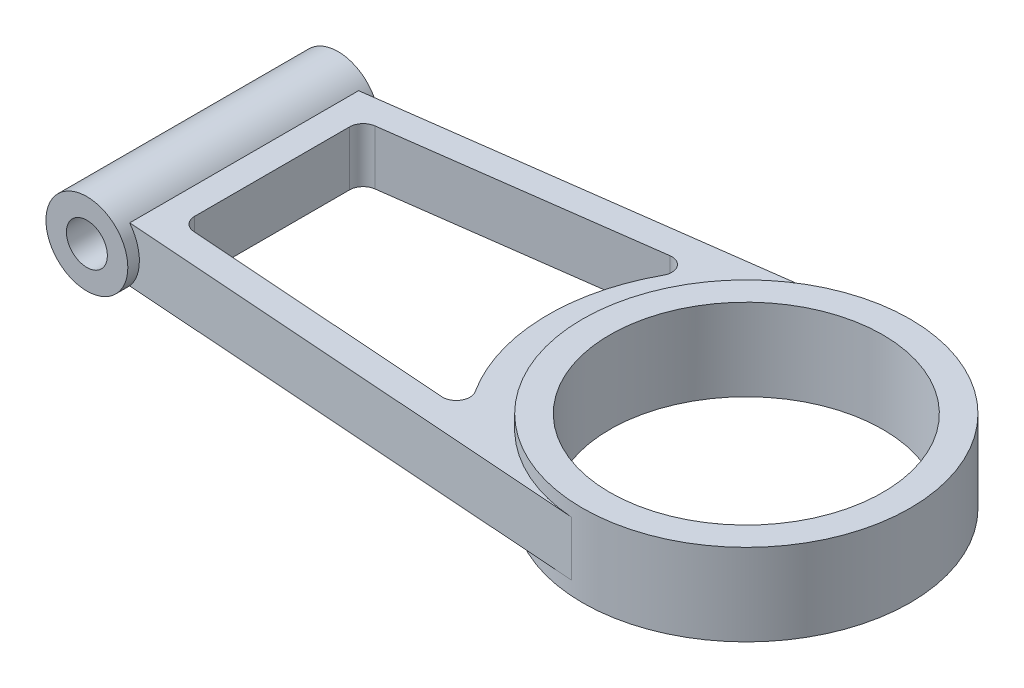
from build123d import *
from build123d.topology import SkipClean

# Parameters (mm, degrees)
SKETCH1_R           = 50
BOSS_EXTRUDE4_DEPTH = 10
SKETCH4_R           = 50
BOSS_EXTRUDE5_DEPTH = 5
BOSS_EXTRUDE6_START = 5
SKETCH5_R           = 50
BOSS_EXTRUDE6_DEPTH = 5
SKETCH9_R           = 15
SKETCH9_R_2         = 7.5
BOSS_EXTRUDE8_DEPTH = 40
CUT_EXTRUDE1_START  = 50
SKETCH11_R          = 15
CUT_EXTRUDE1_DEPTH  = 50
BOSS_EXTRUDE9_START = 12
SKETCH12_R          = 7.5
BOSS_EXTRUDE9_DEPTH = 12


with BuildPart() as part:
    # Sketch1 → Boss-Extrude4 (new, symmetric)
    # profile 1 of 2: a face of its own
    with BuildSketch(Plane(origin=(0, 0, 0), x_dir=(1, 0, 0), z_dir=(0, 1, 0))):
        with BuildLine():
            Line((109.631487436, 59.370873009), (-60.952961118, 36.317806))
            Line((-60.952961118, 36.317806), (-60.952961118, -47.492515538))
            Line((-60.952961118, -47.492515538), (113.395395748, -59.936377162))
            ThreePointArc((113.395395748, -59.936377162), (57.696778774, -1.980561591), (109.631487436, 59.370873009))
        make_face()
        with BuildLine():
            Line((-46.622582391, 28.163534109), (48.543183, 41.024394434))
            ThreePointArc((48.543183, 41.024394434), (53.334657365, 38.899688702), (53.596610708, 33.664807473))
            ThreePointArc((53.596610708, 33.664807473), (45.011329084, -2.407953952), (56.056582269, -37.805038006))
            ThreePointArc((56.056582269, -37.805038006), (56.147884391, -43.057885165), (51.492525841, -45.492710855))
            Line((51.492525841, -45.492710855), (-46.308923365, -38.512273973))
            ThreePointArc((-46.308923365, -38.512273973), (-49.612183114, -36.932319839), (-50.952961118, -33.524960981))
            Line((-50.952961118, -33.524960981), (-50.952961118, 23.208576253))
            ThreePointArc((-50.952961118, 23.208576253), (-49.717805495, 26.498856913), (-46.622582391, 28.163534109))
        make_face(mode=Mode.SUBTRACT)
    # profile 2 of 2: a face of its own
    with BuildSketch(Plane(origin=(0, 0, 0), x_dir=(1, 0, 0), z_dir=(0, 1, 0))):
        with BuildLine():
            ThreePointArc((177.666942704, -0.088621259), (157.15031062, 45.089511261), (109.631487436, 59.370873009))
            ThreePointArc((109.631487436, 59.370873009), (57.696778774, -1.980561591), (113.395395748, -59.936377162))
            ThreePointArc((113.395395748, -59.936377162), (158.555248995, -43.999285211), (177.666942704, -0.088621259))
        make_face()
        with Locations(Location((117.666942704, -0.088621259, 0), (0, 0, 270))):
            Circle(SKETCH1_R, mode=Mode.SUBTRACT)
    extrude(amount=BOSS_EXTRUDE4_DEPTH, both=True)

    # Sketch4 → Boss-Extrude5 (add)
    with BuildSketch(Plane(origin=(0, 10, 0), x_dir=(1, 0, 0), z_dir=(0, 1, 0))):
        with BuildLine():
            ThreePointArc((109.631487436, 59.370873009), (57.696778774, -1.980561591), (113.395395748, -59.936377162))
            ThreePointArc((113.395395748, -59.936377162), (158.555248995, -43.999285211), (177.666942704, -0.088621259))
            ThreePointArc((177.666942704, -0.088621259), (157.15031062, 45.089511261), (109.631487436, 59.370873009))
        make_face()
        with Locations(Location((117.666942704, -0.088621259, 0), (0, 0, 270))):
            Circle(SKETCH4_R, mode=Mode.SUBTRACT)
    extrude(amount=BOSS_EXTRUDE5_DEPTH)

    # Sketch5 → Boss-Extrude6 (add)
    with BuildSketch(Plane.XZ.offset(10).offset(BOSS_EXTRUDE6_START)):
        with BuildLine():
            ThreePointArc((113.395395748, 59.936377162), (57.696778774, 1.980561591), (109.631487436, -59.370873009))
            ThreePointArc((109.631487436, -59.370873009), (157.15031062, -45.089511261), (177.666942704, 0.088621259))
            ThreePointArc((177.666942704, 0.088621259), (158.555248995, 43.999285211), (113.395395748, 59.936377162))
        make_face()
        with Locations(Location((117.666942704, 0.088621259, 0), (0, 0, 270))):
            Circle(SKETCH5_R, mode=Mode.SUBTRACT)
    extrude(amount=-BOSS_EXTRUDE6_DEPTH)

    # Sketch9 → Boss-Extrude8 (add, symmetric)
    with SkipClean():  # the faces are left unmerged after this step: merging them gives an invalid solid
        with BuildSketch(Plane.XY):
            with Locations(Location((-71.952961118, 0, 0), (0, 0, 318.189685104))):
                Circle(SKETCH9_R)
            with Locations((-71.952961118, 0)):
                Circle(SKETCH9_R_2, mode=Mode.SUBTRACT)
        extrude(amount=BOSS_EXTRUDE8_DEPTH, both=True)

    # Sketch11 → Cut-Extrude1 (cut)
    with SkipClean():  # the faces are left unmerged after this step: merging them gives an invalid solid
        with BuildSketch(Plane.XY.offset(40).offset(CUT_EXTRUDE1_START)):
            with Locations(Location((-71.952961118, 0, 0), (0, 0, 318.189685104))):
                Circle(SKETCH11_R)
        extrude(amount=-CUT_EXTRUDE1_DEPTH, mode=Mode.SUBTRACT)

    # Sketch12 → Boss-Extrude9 (add)
    with SkipClean():  # the faces are left unmerged after this step: merging them gives an invalid solid
        with BuildSketch(Plane.XY.offset(40).offset(BOSS_EXTRUDE9_START)):
            with BuildLine():
                ThreePointArc((-60.772621231, 10), (-86.952961118, 0), (-60.772621231, -10))
                ThreePointArc((-60.772621231, -10), (-56.952961118, 0), (-60.772621231, 10))
            make_face()
            with Locations((-71.952961118, 0)):
                Circle(SKETCH12_R, mode=Mode.SUBTRACT)
        extrude(amount=-BOSS_EXTRUDE9_DEPTH)


solid = part.part
